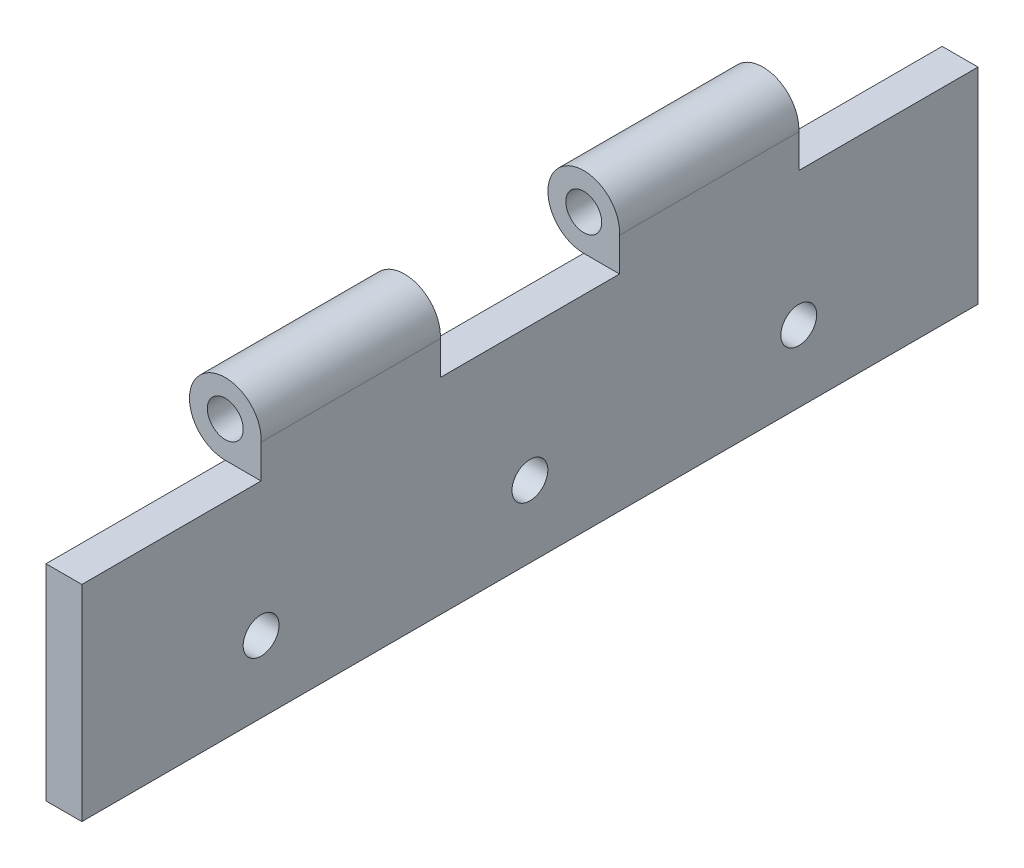
from build123d import *

# Parameters (mm, degrees)
BOSS_EXTRUDE1_DEPTH      = 37.5
BOSS_EXTRUDE1_DEPTH_BACK = 37.5
SKETCH1_R                = 1.5
CUT_EXTRUDE1_DEPTH       = 37.5
CUT_EXTRUDE1_DEPTH_BACK  = 37.5
SKETCH2_R                = 1.5
SKETCH2_W                = 15
SKETCH2_H                = 15


with BuildPart() as part:
    # Sketch1 → Boss-Extrude1 (new, two sides: drawn at the far end of the back side and taken through both)
    with BuildSketch(Plane.XY.offset(-BOSS_EXTRUDE1_DEPTH_BACK)):
        with BuildLine():
            Line((-2, 7.769691362), (-2, -9.423076923))
            Line((-2, -9.423076923), (1, -9.423076923))
            Line((1, -9.423076923), (1, 10.576923077))
            ThreePointArc((1, 10.576923077), (-4.043575876, 12.960215003), (-2, 7.769691362))
        make_face()
        with Locations((-1.993800738, 10.769684957)):
            Circle(SKETCH1_R, mode=Mode.SUBTRACT)
    extrude(amount=BOSS_EXTRUDE1_DEPTH + BOSS_EXTRUDE1_DEPTH_BACK)

    # Sketch2 → Cut-Extrude1 (cut, two sides: drawn at the far end of the back side and taken through both)
    with BuildSketch(Plane.ZY.offset(2).offset(-CUT_EXTRUDE1_DEPTH_BACK)):
        with Locations((-22.5, -3.423076923)):
            Circle(SKETCH2_R)
        with Locations((0, -3.423076923)):
            Circle(SKETCH2_R)
        with Locations((22.5, -3.423076923)):
            Circle(SKETCH2_R)
        with Locations((-30, 15.269691362)):
            Rectangle(SKETCH2_W, SKETCH2_H)
        with Locations((0, 15.269691362)):
            Rectangle(SKETCH2_W, SKETCH2_H)
        with Locations((30, 15.269691362)):
            Rectangle(SKETCH2_W, SKETCH2_H)
    extrude(amount=CUT_EXTRUDE1_DEPTH + CUT_EXTRUDE1_DEPTH_BACK, mode=Mode.SUBTRACT)


solid = part.part
